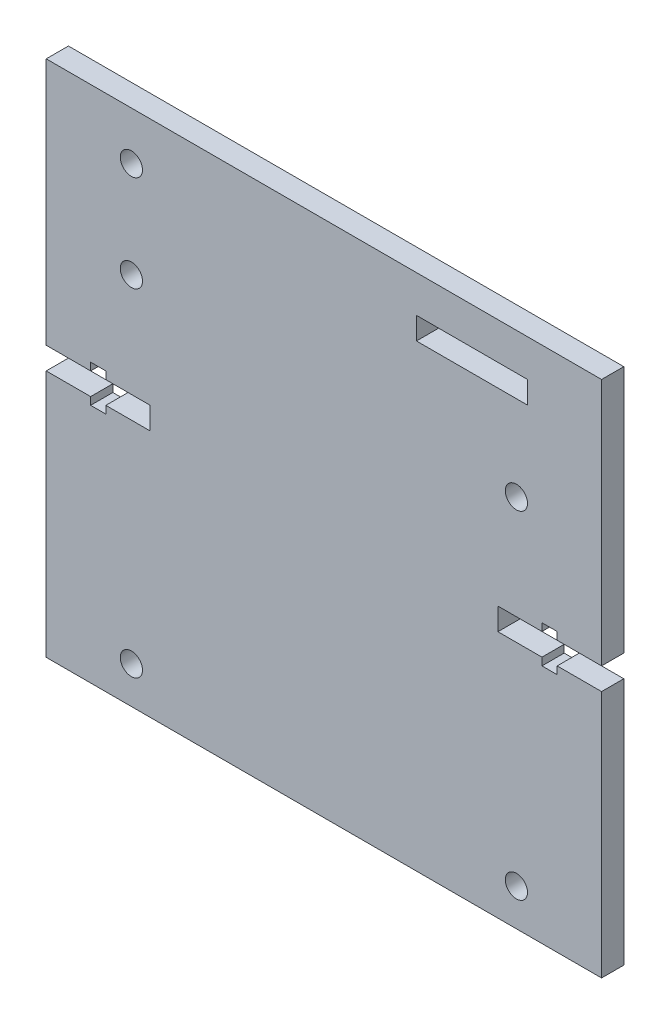
from build123d import *

# Parameters (mm, degrees)
ESQUISSE1_W                  = 75
ESQUISSE1_H                  = 70
ESQUISSE1_R                  = 1.5
ESQUISSE1_W_2                = 15
ESQUISSE1_H_2                = 3
BOSS_EXTRU_1_DEPTH           = 3
ENL_V_MAT_EXTRU_2_DEPTH      = 10
ENL_V_MAT_EXTRU_2_DEPTH_BACK = 10


with BuildPart() as part:
    # Esquisse1 → Boss.-Extru.1 (new body)
    with BuildSketch(Plane.XY):
        with Locations((-12.683673469, -2.836734694)):
            Rectangle(ESQUISSE1_W, ESQUISSE1_H)
        with Locations((-38.683673469, 25.663265306)):
            Circle(ESQUISSE1_R, mode=Mode.SUBTRACT)
        with Locations((-38.683673469, 12.663265306)):
            Circle(ESQUISSE1_R, mode=Mode.SUBTRACT)
        with Locations((13.316326531, 12.663265306)):
            Circle(ESQUISSE1_R, mode=Mode.SUBTRACT)
        with Locations((-38.683673469, -32.836734694)):
            Circle(ESQUISSE1_R, mode=Mode.SUBTRACT)
        with Locations((13.316326531, -32.836734694)):
            Circle(ESQUISSE1_R, mode=Mode.SUBTRACT)
        with Locations((7.316326531, 25.663265306)):
            Rectangle(ESQUISSE1_W_2, ESQUISSE1_H_2, mode=Mode.SUBTRACT)
    extrude(amount=BOSS_EXTRU_1_DEPTH)

    # Esquisse2 → Enlèv. mat.-Extru.2 (cut, two sides: drawn at the far end of the back side and taken through both)
    with BuildSketch(Plane.XY.offset(-ENL_V_MAT_EXTRU_2_DEPTH_BACK)):
        Polygon((24.816326531, -1.336734694), (18.816326531, -1.336734694), (18.816326531, -0.311734694), (16.766326531, -0.311734694), (16.766326531, -1.336734694), (10.816326531, -1.336734694), (10.816326531, -4.336734694), (16.766326531, -4.336734694), (16.766326531, -5.361734694), (18.816326531, -5.361734694), (18.816326531, -4.336734694), (24.816326531, -4.336734694), align=None)
        Polygon((-50.183673469, -1.336734694), (-50.183673469, -4.336734694), (-44.183673469, -4.336734694), (-44.183673469, -5.361734694), (-42.133673469, -5.361734694), (-42.133673469, -4.336734694), (-36.183673469, -4.336734694), (-36.183673469, -1.336734694), (-42.133673469, -1.336734694), (-42.133673469, -0.311734694), (-44.183673469, -0.311734694), (-44.183673469, -1.336734694), align=None)
    extrude(amount=ENL_V_MAT_EXTRU_2_DEPTH + ENL_V_MAT_EXTRU_2_DEPTH_BACK, mode=Mode.SUBTRACT)


solid = part.part
